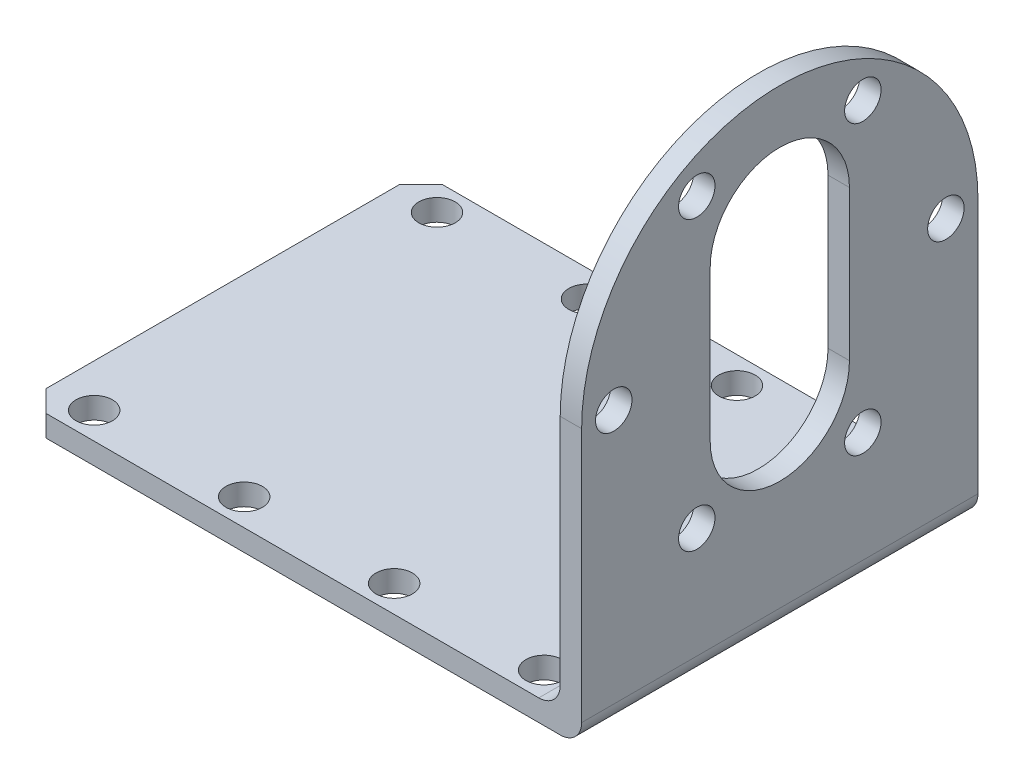
from build123d import *

# Parameters (mm, degrees)
CROQUIS1_W                   = 52
CROQUIS1_H                   = 37
SALIENTE_EXTRUIR1_DEPTH      = 2
TALADRO_DE_MARGEN_PARA_M33_D = 3.4
CROQUIS9_W                   = 2
CROQUIS9_H                   = 37
SALIENTE_EXTRUIR2_DEPTH      = 42.26
CHAFL_N1_SIZE                = 2
REDONDEO1_RADIUS             = 18.5
REDONDEO1_LENGTH             = 2
TALADRO_DE_MARGEN_PARA_M34_D = 3.4
CORTAR_EXTRUIR1_DEPTH        = 70.290674697
REDONDEO3_R                  = 2
REDONDEO4_R                  = 2


with BuildPart() as part:
    # Croquis1 → Saliente-Extruir1 (new body)
    with BuildSketch(Plane(origin=(0, 0, 0), x_dir=(1, 0, 0), z_dir=(0, 1, 0))):
        Rectangle(CROQUIS1_W, CROQUIS1_H)
    extrude(amount=SALIENTE_EXTRUIR1_DEPTH)

    # Taladro de margen para M33 (through all)
    with Locations(Plane(origin=(0, 2, 0), x_dir=(1, 0, 0), z_dir=(0, 1, 0))):
        with Locations((-22, 16), (-8, 16), (6, 16), (20, 16), (-22, -16), (-8, -16), (6, -16), (20, -16)):
            Hole(TALADRO_DE_MARGEN_PARA_M33_D / 2)

    # Croquis9 → Saliente-Extruir2 (add)
    with BuildSketch(Plane(origin=(0, 2, 0), x_dir=(1, 0, 0), z_dir=(0, 1, 0))):
        with Locations((25, 0)):
            Rectangle(CROQUIS9_W, CROQUIS9_H)
    extrude(amount=SALIENTE_EXTRUIR2_DEPTH)

    # Chaflán1
    chafl_n1_edges = [part.edges().sort_by_distance(p)[0] for p in [
        (-26, 1, 18.5),
        (-26, 1, -18.5),
    ]]
    chamfer(chafl_n1_edges, length=CHAFL_N1_SIZE)

    # Redondeo1: full round fillet: the end face becomes a half cylinder, R = half its width
    redondeo1_face = Plane((25, 44.26, 0), x_dir=(-1, 0, 0), z_dir=(0, 1, 0))  # on the end face: x along it, z out of the body
    redondeo1_slab = redondeo1_face.offset(-REDONDEO1_RADIUS / 2) * Box(REDONDEO1_LENGTH, 2 * REDONDEO1_RADIUS, REDONDEO1_RADIUS, mode=Mode.PRIVATE)  # the body's end, R deep
    redondeo1_round = Plane((25, 25.76, 0), x_dir=(0, 1, 0), z_dir=(-1, 0, 0)) * Cylinder(REDONDEO1_RADIUS, REDONDEO1_LENGTH, mode=Mode.PRIVATE)  # its axis R under the face
    add(redondeo1_slab - redondeo1_round, mode=Mode.SUBTRACT)

    # Taladro de margen para M34 (through all)
    with Locations(Plane.ZY.offset(-24)):
        with Locations((-15.5, 25.76), (-7.75, 39.183393759), (7.75, 39.183393759), (15.5, 25.76), (7.75, 12.336606241), (-7.75, 12.336606241)):
            Hole(TALADRO_DE_MARGEN_PARA_M34_D / 2)

    # Croquis15 → Cortar-Extruir1 (cut, through all)
    with BuildSketch(Plane.ZY.offset(-24)):
        with BuildLine():
            Line((-6.5, 18.76), (-6.5, 32.76))
            ThreePointArc((-6.5, 32.76), (0, 39.26), (6.5, 32.76))
            Line((6.5, 32.76), (6.5, 18.76))
            ThreePointArc((6.5, 18.76), (0, 12.26), (-6.5, 18.76))
        make_face()
    extrude(amount=-CORTAR_EXTRUIR1_DEPTH, mode=Mode.SUBTRACT)

    # Redondeo3
    redondeo3_edges = [part.edges().sort_by_distance(p)[0] for p in [
        (26, 0, 0),
    ]]
    fillet(redondeo3_edges, radius=REDONDEO3_R)

    # Redondeo4
    redondeo4_edges = [part.edges().sort_by_distance(p)[0] for p in [
        (24, 2, 0),
    ]]
    fillet(redondeo4_edges, radius=REDONDEO4_R)


solid = part.part
